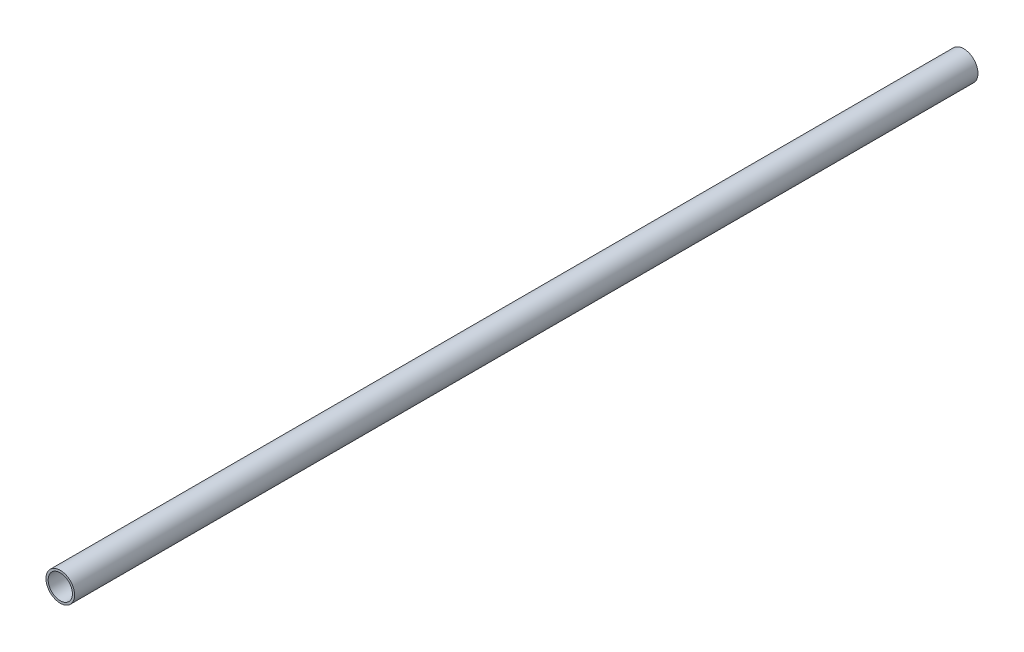
from build123d import *

# Parameters (mm, degrees)
BOSS_EXTRUDE1_DEPTH      = 762
BOSS_EXTRUDE1_DEPTH_BACK = 762
SKETCH3_R                = 24.13
SKETCH3_R_2              = 20.447


with BuildPart() as part:
    # Sketch3 → Boss-Extrude1 (new, two sides: drawn at the far end of the back side and taken through both)
    with BuildSketch(Plane.XY.offset(-BOSS_EXTRUDE1_DEPTH_BACK)):
        Circle(SKETCH3_R)
        Circle(SKETCH3_R_2, mode=Mode.SUBTRACT)
    extrude(amount=BOSS_EXTRUDE1_DEPTH + BOSS_EXTRUDE1_DEPTH_BACK)


solid = part.part
